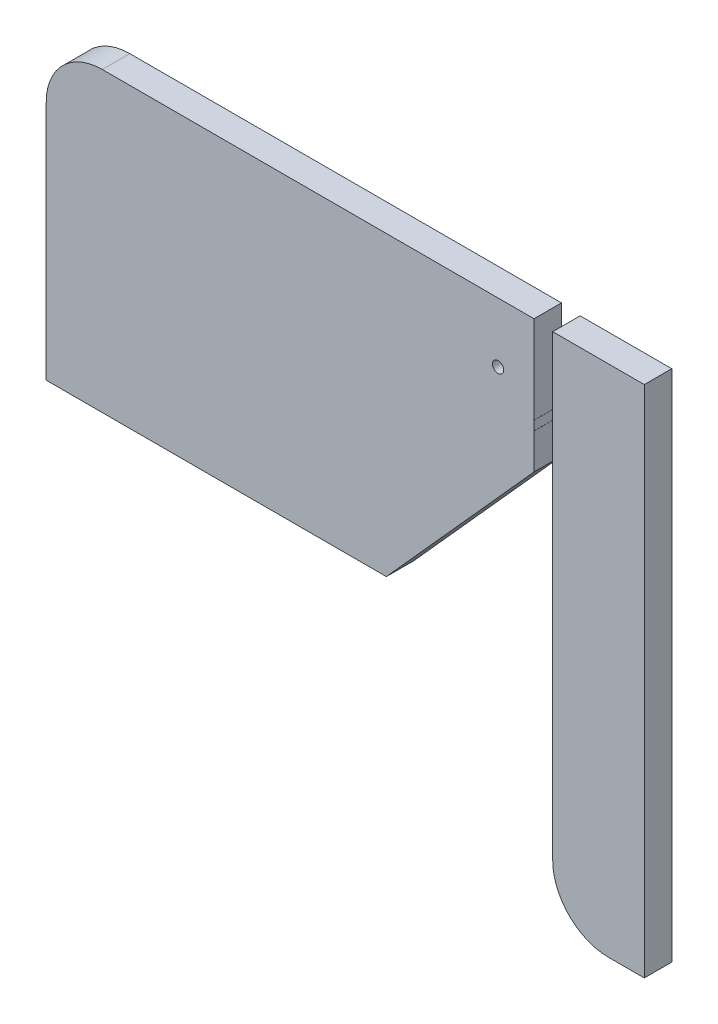
from build123d import *

# Parameters (mm, degrees)
MODEL_R               = 0.3
BOSS_EXTRUDE1_DEPTH   = 1.47
BOSS_EXTRUDE1_2_DEPTH = 1.47


with BuildPart() as part:
    # Model → Boss-Extrude1 (new body)
    with BuildSketch(Plane.XY):
        with BuildLine():
            Line((0.3, 26.3), (0.3, 13.4))
            Line((0.3, 13.4), (18.5, 13.4))
            Line((18.5, 13.4), (26.4, 22.2))
            Line((26.4, 22.2), (26.4, 24.0975))
            ThreePointArc((26.4, 24.0975), (26.3975, 24.1), (26.4, 24.1025))
            Line((26.4, 24.1025), (26.4, 24.5975))
            ThreePointArc((26.4, 24.5975), (26.3975, 24.6), (26.4, 24.6025))
            Line((26.4, 24.6025), (26.4, 29.3))
            Line((26.4, 29.3), (3.3, 29.3))
            ThreePointArc((3.3, 29.3), (1.178679656, 28.421320344), (0.3, 26.3))
        make_face()
        with Locations((24.475, 26.1)):
            Circle(MODEL_R, mode=Mode.SUBTRACT)
    extrude(amount=BOSS_EXTRUDE1_DEPTH)


with BuildPart() as body_2:
    # Model → Boss-Extrude1 2 (new body)
    with BuildSketch(Plane.XY):
        with BuildLine():
            Line((32.3, 29.2), (27.4, 29.2))
            Line((27.4, 29.2), (27.4, 24.6025))
            ThreePointArc((27.4, 24.6025), (27.4025, 24.6), (27.4, 24.5975))
            Line((27.4, 24.5975), (27.4, 24.1025))
            ThreePointArc((27.4, 24.1025), (27.4025, 24.1), (27.4, 24.0975))
            Line((27.4, 24.0975), (27.4, 4.7))
            ThreePointArc((27.4, 4.7), (28.278679656, 2.578679656), (30.4, 1.7))
            Line((30.4, 1.7), (32.3, 1.7))
            Line((32.3, 1.7), (32.3, 29.2))
        make_face()
    extrude(amount=BOSS_EXTRUDE1_2_DEPTH)


solid = Compound([part.part, body_2.part])
